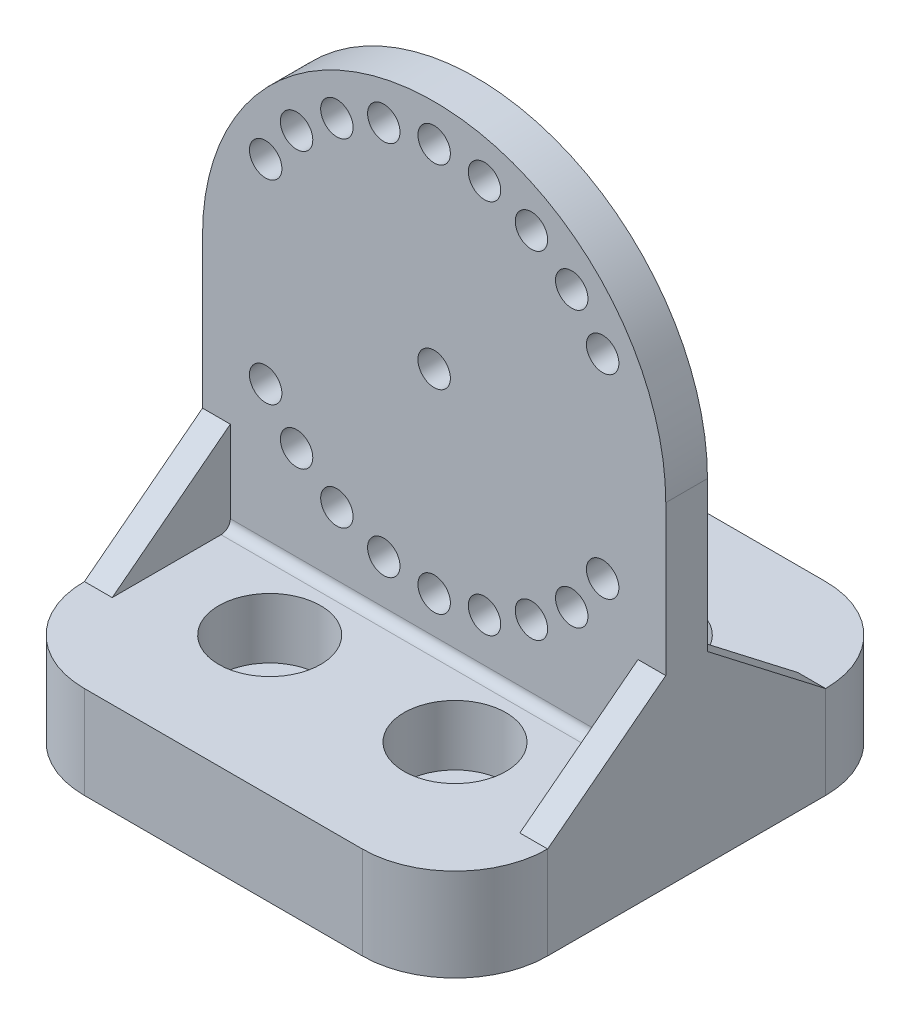
from build123d import *

# Parameters (mm, degrees)
SKETCH_1_W               = 50
SKETCH_1_H               = 50
EXTRUDE_1_DEPTH          = 10
SKETCH_2_R               = 1.75
EXTRUDE_2_DEPTH          = 2.25
CUT_EXTRUDE_1_DEPTH      = 71.505318948
CUT_EXTRUDE_1_DEPTH_BACK = 71.505318948
SKETCH_5_R               = 1.75
CUT_EXTRUDE_3_DEPTH      = 71.505318948
CUT_EXTRUDE_3_DEPTH_BACK = 5
SKETCH_6_R               = 3.3
FILLET_1_R               = 10
SKETCH_8_R               = 5.5
CUT_EXTRUDE_5_DEPTH      = 6.5
EXTRUDE_3_DEPTH          = 3
EXTRUDE_4_DEPTH          = 3
FILLET_2_R               = 1


with BuildPart() as part:
    # ｽｹｯﾁ1 → ﾎﾞｽ - 押し出し1 (new body)
    with BuildSketch(Plane(origin=(0, 0, 0), x_dir=(1, 0, 0), z_dir=(0, 1, 0))):
        Rectangle(SKETCH_1_W, SKETCH_1_H)
    extrude(amount=EXTRUDE_1_DEPTH)

    # ｽｹｯﾁ2 → ﾎﾞｽ - 押し出し2 (add, symmetric)
    with BuildSketch(Plane.XY):
        with BuildLine():
            Line((25, 10), (-25, 10))
            Line((-25, 10), (-25, 36))
            ThreePointArc((-25, 36), (0, 61), (25, 36))
            Line((25, 36), (25, 10))
        make_face()
        with Locations((0, 36)):
            Circle(SKETCH_2_R, mode=Mode.SUBTRACT)
    extrude(amount=EXTRUDE_2_DEPTH, both=True)

    # ｽｹｯﾁ5 → ｶｯﾄ - 押し出し1 (cut, two sides: drawn at the far end of the back side and taken through both)
    with BuildSketch(Plane.XY.offset(-CUT_EXTRUDE_1_DEPTH_BACK)):
        with Locations((0, 57)):
            Circle(SKETCH_5_R)
        with Locations((5.435199947, 56.284442352)):
            Circle(SKETCH_5_R)
        with Locations((10.5, 54.186533479)):
            Circle(SKETCH_5_R)
        with Locations((14.849242405, 50.849242405)):
            Circle(SKETCH_5_R)
        with Locations((18.186533479, 46.5)):
            Circle(SKETCH_5_R)
        with Locations((18.186533479, 25.5)):
            Circle(SKETCH_5_R)
        with Locations((14.849242405, 21.150757595)):
            Circle(SKETCH_5_R)
        with Locations((10.5, 17.813466521)):
            Circle(SKETCH_5_R)
        with Locations((5.435199947, 15.715557648)):
            Circle(SKETCH_5_R)
        with Locations((0, 15)):
            Circle(SKETCH_5_R)
        with Locations((-5.435199947, 15.715557648)):
            Circle(SKETCH_5_R)
        with Locations((-10.5, 17.813466521)):
            Circle(SKETCH_5_R)
        with Locations((-14.849242405, 21.150757595)):
            Circle(SKETCH_5_R)
        with Locations((-18.186533479, 25.5)):
            Circle(SKETCH_5_R)
        with Locations((-18.186533479, 46.5)):
            Circle(SKETCH_5_R)
        with Locations((-14.849242405, 50.849242405)):
            Circle(SKETCH_5_R)
        with Locations((-10.5, 54.186533479)):
            Circle(SKETCH_5_R)
        with Locations((-5.435199947, 56.284442352)):
            Circle(SKETCH_5_R)
    extrude(amount=CUT_EXTRUDE_1_DEPTH + CUT_EXTRUDE_1_DEPTH_BACK, mode=Mode.SUBTRACT)

    # ｽｹｯﾁ6 → ｶｯﾄ - 押し出し3 (cut, two sides: drawn at the far end of the back side and taken through both)
    with BuildSketch(Plane(origin=(0, 0, 0), x_dir=(1, 0, 0), z_dir=(0, 1, 0)).offset(-CUT_EXTRUDE_3_DEPTH_BACK)):
        with Locations(Location((-10, -10, 0), (0, 0, 90))):
            Circle(SKETCH_6_R)
        with Locations(Location((10, -10, 0), (0, 0, 90))):
            Circle(SKETCH_6_R)
        with Locations(Location((10, 10, 0), (0, 0, 90))):
            Circle(SKETCH_6_R)
        with Locations(Location((-10, 10, 0), (0, 0, 90))):
            Circle(SKETCH_6_R)
    extrude(amount=CUT_EXTRUDE_3_DEPTH + CUT_EXTRUDE_3_DEPTH_BACK, mode=Mode.SUBTRACT)

    # ﾌｨﾚｯﾄ1
    fillet_1_edges = [part.edges().sort_by_distance(p)[0] for p in [
        (-25, 5, 25),
        (-25, 5, -25),
        (25, 5, -25),
        (25, 5, 25),
    ]]
    fillet(fillet_1_edges, radius=FILLET_1_R)

    # ｽｹｯﾁ8 → ｶｯﾄ - 押し出し5 (cut)
    with BuildSketch(Plane(origin=(0, 10, 0), x_dir=(1, 0, 0), z_dir=(0, 1, 0))):
        with Locations(Location((-10, -10, 0), (0, 0, 270))):
            Circle(SKETCH_8_R)
        with Locations(Location((10, -10, 0), (0, 0, 270))):
            Circle(SKETCH_8_R)
        with Locations(Location((10, 10, 0), (0, 0, 270))):
            Circle(SKETCH_8_R)
        with Locations(Location((-10, 10, 0), (0, 0, 270))):
            Circle(SKETCH_8_R)
    extrude(amount=-CUT_EXTRUDE_5_DEPTH, mode=Mode.SUBTRACT)

    # ｽｹｯﾁ11 → ﾎﾞｽ - 押し出し3 (add)
    with BuildSketch(Plane(origin=(25, 0, 0), x_dir=(0, 0, -1), z_dir=(1, 0, 0))):
        Polygon((-2.25, 19.834192463), (-15, 10), (-2.25, 10), align=None)
        Polygon((15, 10), (2.25, 10), (2.25, 19.834192463), align=None)
    extrude(amount=-EXTRUDE_3_DEPTH)

    # ｽｹｯﾁ12 → ﾎﾞｽ - 押し出し4 (add)
    with BuildSketch(Plane.ZY.offset(25)):
        Polygon((2.25, 19.834192463), (15, 10), (2.25, 10), align=None)
        Polygon((-2.25, 19.834192463), (-15, 10), (-2.25, 10), align=None)
    extrude(amount=-EXTRUDE_4_DEPTH)

    # ﾌｨﾚｯﾄ2
    fillet_2_edges = [part.edges().sort_by_distance(p)[0] for p in [
        (0, 10, 2.25),
        (0, 10, -2.25),
    ]]
    fillet(fillet_2_edges, radius=FILLET_2_R)


solid = part.part
